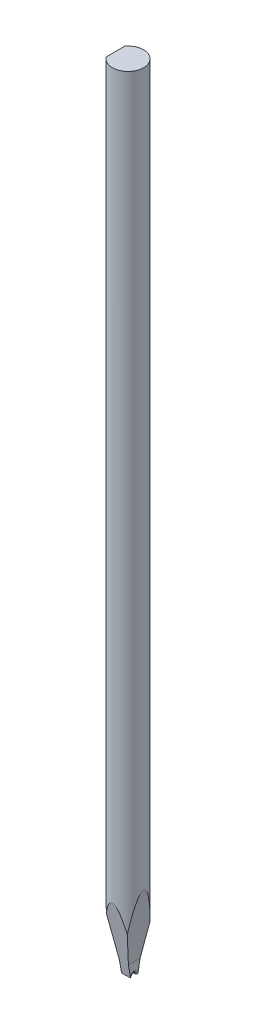
from build123d import *

# Parameters (mm, degrees)
SKETCH_TL_CUTTING_R    = 1.4986
TL_CUTTING_DEPTH       = 75.9968
SKETCH_TDF_CUTTING_W   = 3.01719996
SKETCH_TDF_CUTTING_H   = 3.01719996
TDF_CUTTING_DEPTH      = 77.026345527
VW_VR_GRINDING_DEPTH   = 1.50859998
VW_VR_GRINDING_2_DEPTH = 1.50859998
ISA_GRINDING_DEPTH     = 1.50859998
SKETCH_PRE_FRX_BRX_W   = 0.88916002
SKETCH_PRE_FRX_BRX_H   = 1.1938
SKETCH_PRE_FRX_BRX_W_2 = 1.24935996
PRE_FRX_BRX_DEPTH      = 1.50859998
FA_BA_GRINDING_DEPTH   = 1.50859998
BR_EDM_R               = 0.20066
FR_EDM_R               = 0.20066
ENGRAVING_DEPTH        = 0.005


with BuildPart() as part:
    # sketch_TL_cutting → TL_cutting (new body)
    with BuildSketch(Plane(origin=(0, 0, 0), x_dir=(1, 0, 0), z_dir=(0, 1, 0))):
        with Locations(Location((0, 0, 0), (0, 0, 270))):
            Circle(SKETCH_TL_CUTTING_R)
    extrude(amount=TL_CUTTING_DEPTH)

    # sketch_TDF_cutting → TDF_cutting (cut, through all)
    with BuildSketch(Plane(origin=(0, 0, 0), x_dir=(1, 0, 0), z_dir=(0, 1, 0))):
        with Locations((-2.71001998, 0)):
            Rectangle(SKETCH_TDF_CUTTING_W, SKETCH_TDF_CUTTING_H)
    extrude(amount=TDF_CUTTING_DEPTH, mode=Mode.SUBTRACT)


with BuildPart() as body_2:
    # sketch_VW_VR_grinding → VW_VR_grinding (new, symmetric)
    with BuildSketch(Plane(origin=(0, 0, 0), x_dir=(0, 0, -1), z_dir=(1, 0, 0))):
        with BuildLine():
            Line((-1.49360001, -0.00999998), (-1.49360001, 1.182688914))
            ThreePointArc((-1.49360001, 1.182688914), (-1.493648337, 1.183795792), (-1.493792952, 1.184894246))
            Line((-1.493792952, 1.184894246), (-1.51859996, 1.325581782))
            Line((-1.51859996, 1.325581782), (-1.50859998, -0.00999998))
            Line((-1.50859998, -0.00999998), (-1.49360001, -0.00999998))
        make_face()
    extrude(amount=VW_VR_GRINDING_DEPTH, both=True)


with BuildPart() as body_3:
    # sketch_VW_VR_grinding → VW_VR_grinding 2 (new, symmetric)
    with BuildSketch(Plane(origin=(0, 0, 0), x_dir=(0, 0, -1), z_dir=(1, 0, 0))):
        with BuildLine():
            Line((1.49360001, -0.00999998), (1.49360001, 1.182688914))
            ThreePointArc((1.49360001, 1.182688914), (1.493648337, 1.183795792), (1.493792952, 1.184894246))
            Line((1.493792952, 1.184894246), (1.51859996, 1.325581782))
            Line((1.51859996, 1.325581782), (1.50859998, -0.00999998))
            Line((1.50859998, -0.00999998), (1.49360001, -0.00999998))
        make_face()
    extrude(amount=VW_VR_GRINDING_2_DEPTH, both=True)


    add(body_2.part)  # ISA_grinding merges body 2
    # sketch_ISA_grinding → ISA_grinding (add, symmetric)
    with BuildSketch(Plane(origin=(0, 0, 0), x_dir=(0, 0, -1), z_dir=(1, 0, 0))):
        Polygon((-0.35052, 0), (0.35052, 0), (1.50859998, 6.567797936), (1.50859998, -0.02999994), (-1.50859998, -0.02999994), (-1.50859998, 6.567797936), align=None)
    extrude(amount=ISA_GRINDING_DEPTH, both=True)

    # sketch_pre_FRX_BRX → pre_FRX_BRX (add, symmetric)
    with BuildSketch(Plane.XY):
        with Locations((1.05401999, 0.58690002)):
            Rectangle(SKETCH_PRE_FRX_BRX_W, SKETCH_PRE_FRX_BRX_H)
        with Locations((-0.89391998, 0.58690002)):
            Rectangle(SKETCH_PRE_FRX_BRX_W_2, SKETCH_PRE_FRX_BRX_H)
    extrude(amount=PRE_FRX_BRX_DEPTH, both=True)

    # sketch_FA_BA_grinding → FA_BA_grinding (add, symmetric)
    with BuildSketch(Plane.XY):
        Polygon((0.59944, -0.00999998), (0.59944, 1.1938), (1.6256, 8.495307794), (1.6256, -0.00999998), align=None)
        Polygon((-0.26924, -0.00999998), (-0.26924, 1.1938), (-1.32842, 8.730257303), (-1.32842, -0.00999998), align=None)
    extrude(amount=FA_BA_GRINDING_DEPTH, both=True)


with BuildPart() as part_1:
    add(part.part)

    # B1_fix: cut body 3
    add(body_3.part, mode=Mode.SUBTRACT)

    # V-Groove_EDM: sweep along a path in sketch_contour_V-Groove
    with BuildLine(Plane.XY) as v_groove_edm_path:
        Line((-1.20142, 0.254), (1.4986, 0.254))
    # sketch_section_V-Groove → V-Groove_EDM (sweep, cut)
    with BuildSketch(Plane(origin=(-1.20142, 0, -1.2954), x_dir=(0, 0, -1), z_dir=(1, 0, 0))):
        with BuildLine():
            Line((-1.228819322, 0.219340293), (-1.068233534, -0.00999998))
            Line((-1.068233534, -0.00999998), (-1.522566466, -0.00999998))
            Line((-1.522566466, -0.00999998), (-1.361980678, 0.219340293))
            ThreePointArc((-1.361980678, 0.219340293), (-1.2954, 0.254), (-1.228819322, 0.219340293))
        make_face()
    sweep(path=v_groove_edm_path.line, mode=Mode.SUBTRACT)

    # BR_EDM
    br_edm_edges = [part_1.edges().sort_by_distance(p)[0] for p in [
        (-0.26924, 0.254, 0),
        (-0.26924, 0.109670146, -0.143372541),
        (-0.26924, 0.109670146, 0.143372541),
    ]]
    fillet(br_edm_edges, radius=BR_EDM_R)

    # FR_EDM
    fr_edm_edges = [part_1.edges().sort_by_distance(p)[0] for p in [
        (0.59944, 0.109670146, -0.143372541),
        (0.59944, 0.109670146, 0.143372541),
        (0.59944, 0.254, 0),
    ]]
    fillet(fr_edm_edges, radius=FR_EDM_R)

    # sketch_Engraving → Engraving (cut)
    # profile 1 of 9: a face of its own
    with BuildSketch(Plane.ZY.offset(1.20142)):
        Polygon((-1.243778574, 44.904278925), (-1.116218735, 45.030283156), (-0.926693853, 45.157065191), (-0.67598173, 45.284884298), (-0.359674813, 45.346849342), (-0.105332939, 45.346849342), (0.210973979, 45.284884298), (0.463500977, 45.157065191), (0.65302586, 45.030283156), (0.780585699, 44.904278925), (0.75880719, 44.88327822), (0.635654906, 45.008245379), (0.449500507, 45.132434734), (0.200343992, 45.255846286), (-0.10896269, 45.318848401), (-0.356045061, 45.318848401), (-0.665351744, 45.255846286), (-0.912693382, 45.132434734), (-1.098847782, 45.008245379), (-1.222000065, 44.88327822), align=None)
    # profile 2 of 9: a face of its own
    with BuildSketch(Plane.ZY.offset(1.20142)):
        Polygon((-1.044660777, 44.315429522), (-0.806912053, 44.315429522), (-0.747280421, 44.498991242), (-0.620498386, 44.630699368), (-0.598460609, 44.608402323), (-0.722909232, 44.484731503), (-0.777874041, 44.315429522), (-0.070331763, 44.315429522), (-0.052701542, 44.369097991), (0.010559842, 44.498731974), (0.077450977, 44.565623109), (0.208899835, 44.630699368), (0.344496981, 44.630699368), (0.477501447, 44.496917098), (0.539207223, 44.315429522), (0.780585699, 44.315429522), (0.780585699, 44.282243223), (0.544392582, 44.282243223), (0.544392582, 44.066532275), (0.780585699, 44.066532275), (0.780585699, 44.033345976), (0.539207223, 44.033345976), (0.477760715, 43.849006453), (0.35097868, 43.71807613), (0.328940903, 43.739336103), (0.453389527, 43.864043995), (0.508354335, 44.033345976), (-0.135667291, 44.033345976), (-0.153297512, 43.979677507), (-0.216558896, 43.849265721), (-0.283450031, 43.782374586), (-0.414898889, 43.71807613), (-0.614016686, 43.71807613), (-0.747021153, 43.851080596), (-0.806912053, 44.033345976), (-1.044660777, 44.033345976), (-1.044660777, 44.066532275), (-0.811838144, 44.066532275), (-0.811838144, 44.282243223), (-1.044660777, 44.282243223), align=None)
        Polygon((-0.777874041, 44.033345976), (-0.722390696, 43.87104423), (-0.602608896, 43.752040234), (-0.422936196, 43.752040234), (-0.30133952, 43.813227473), (-0.242226424, 43.872859105), (-0.178705773, 43.994455781), (-0.164705303, 44.037234995), align=None, mode=Mode.SUBTRACT)
        Polygon((-0.081739554, 44.282243223), (-0.778392576, 44.282243223), (-0.778392576, 44.066532275), (-0.155371656, 44.066532275), align=None, mode=Mode.SUBTRACT)
        Polygon((0.509132139, 44.282243223), (-0.05166447, 44.282243223), (-0.125037304, 44.066532275), (0.509132139, 44.066532275), align=None, mode=Mode.SUBTRACT)
        Polygon((-0.042071555, 44.315429522), (0.508354335, 44.311540503), (0.452870991, 44.481620288), (0.333089191, 44.59984648), (0.21590007, 44.59984648), (0.095340467, 44.539437044), (0.03622737, 44.48006468), (-0.027034013, 44.358208736), align=None, mode=Mode.SUBTRACT)
    # profile 3 of 9: a face of its own
    with BuildSketch(Plane.ZY.offset(1.20142)):
        Polygon((-0.124518768, 42.895885559), (-0.124518768, 43.384087137), (-0.785133544, 43.384087137), (-0.785133544, 42.582689857), (-0.81235668, 42.582689857), (-0.81235668, 43.412088078), (0.531688452, 43.412088078), (0.531688452, 42.582689857), (0.502909708, 42.582689857), (0.502909708, 43.384087137), (-0.095740024, 43.384087137), (-0.095740024, 42.895885559), align=None)
    # profile 4 of 9: a face of its own
    with BuildSketch(Plane.ZY.offset(1.20142)):
        Polygon((-0.79576353, 42.311962247), (0.085488284, 42.311962247), (0.085488284, 42.283961307), (-0.131519003, 42.283961307), (0.03622737, 42.118548345), (0.100266558, 41.988395827), (0.100266558, 41.792389245), (0.034412495, 41.658347707), (-0.138778506, 41.602345826), (0.03622737, 41.429154825), (0.100266558, 41.297965235), (0.100266558, 41.102736457), (0.034412495, 40.967917115), (-0.164186767, 40.904137196), (-0.79576353, 40.904137196), (-0.79576353, 40.932138136), (-0.17014993, 40.932138136), (0.009263502, 40.993325376), (0.068895134, 41.109736692), (0.068895134, 41.290965), (0.007448626, 41.4107468), (-0.173520413, 41.593530715), (-0.79576353, 41.593530715), (-0.79576353, 41.622568728), (-0.17014993, 41.622568728), (0.009263502, 41.682978163), (0.068895134, 41.800167284), (0.068895134, 41.98035852), (0.007448626, 42.101177391), (-0.173520413, 42.283961307), (-0.79576353, 42.283961307), align=None)
    # profile 5 of 9: a face of its own
    with BuildSketch(Plane.ZY.offset(1.20142)):
        Polygon((0.086525356, 40.503516336), (-0.067479816, 40.503516336), (0.036486638, 40.40110549), (0.100266558, 40.269915899), (0.100266558, 40.074946389), (0.036486638, 39.944534603), (-0.094702952, 39.81490062), (-0.287598318, 39.750083629), (-0.416973033, 39.750083629), (-0.610127667, 39.81490062), (-0.740280186, 39.944534603), (-0.803282301, 40.074946389), (-0.803282301, 40.269915899), (-0.740280186, 40.40110549), (-0.636313731, 40.503516336), (-1.227185424, 40.503516336), (-1.227185424, 40.531517276), (0.086525356, 40.531517276), align=None)
        Polygon((-0.110518298, 40.503516336), (-0.601571824, 40.503516336), (-0.72057582, 40.382956732), (-0.780985256, 40.262915664), (-0.780985256, 40.081946624), (-0.72057582, 39.961905556), (-0.599756948, 39.840308881), (-0.416973033, 39.779121641), (-0.295117089, 39.779121641), (-0.112333174, 39.840308881), (0.007448626, 39.961905556), (0.068895134, 40.081946624), (0.068895134, 40.262915664), (0.007448626, 40.382956732), align=None, mode=Mode.SUBTRACT)
    # profile 6 of 9: a face of its own
    with BuildSketch(Plane.ZY.offset(1.20142)):
        Polygon((-0.81235668, 39.041193158), (-0.81235668, 39.169790069), (-0.747798957, 39.304609411), (-0.551273839, 39.369426402), (0.062672703, 39.369426402), (0.062672703, 39.542617403), (0.090673643, 39.542617403), (0.090673643, 39.369426402), (0.515095302, 39.369426402), (0.515095302, 39.34038839), (0.090673643, 39.34038839), (0.090673643, 39.10341747), (0.062672703, 39.10341747), (0.062672703, 39.34038839), (-0.547644087, 39.34038839), (-0.726798251, 39.27920115), (-0.785392812, 39.162789834), (-0.785392812, 39.041193158), align=None)
    # profile 7 of 9: a face of its own
    with BuildSketch(Plane.ZY.offset(1.20142)):
        Polygon((-1.21499983, 38.953508732), (-1.21499983, 38.8938771), (-1.154071858, 38.7740953), (-1.033252986, 38.652498624), (-0.794985726, 38.530901949), (0.073302689, 38.903729283), (0.083673408, 38.878321022), (-0.759206747, 38.514308799), (0.083673408, 38.150296576), (0.073302689, 38.125666119), (-0.79835621, 38.501863937), (-1.051661012, 38.627090364), (-1.179480119, 38.756724347), (-1.243778574, 38.886876865), (-1.243778574, 38.953508732), align=None)
    # profile 8 of 9: a face of its own
    with BuildSketch(Plane.ZY.offset(1.20142)):
        Polygon((-1.044660777, 37.631708792), (-0.806912053, 37.631708792), (-0.747280421, 37.815270511), (-0.620498386, 37.946978637), (-0.598460609, 37.924681592), (-0.722909232, 37.801010773), (-0.777874041, 37.631708792), (-0.070331763, 37.631708792), (-0.052701542, 37.68537726), (0.010559842, 37.815011243), (0.077450977, 37.881902378), (0.208899835, 37.946978637), (0.344496981, 37.946978637), (0.477501447, 37.813196367), (0.539207223, 37.631708792), (0.780585699, 37.631708792), (0.780585699, 37.598522492), (0.544392582, 37.598522492), (0.544392582, 37.382811545), (0.780585699, 37.382811545), (0.780585699, 37.349625245), (0.539207223, 37.349625245), (0.477760715, 37.165285722), (0.35097868, 37.0343554), (0.328940903, 37.055615373), (0.453389527, 37.180323264), (0.508354335, 37.349625245), (-0.135667291, 37.349625245), (-0.153297512, 37.295956777), (-0.216558896, 37.16554499), (-0.283450031, 37.098653855), (-0.414898889, 37.0343554), (-0.614016686, 37.0343554), (-0.747021153, 37.167359866), (-0.806912053, 37.349625245), (-1.044660777, 37.349625245), (-1.044660777, 37.382811545), (-0.811838144, 37.382811545), (-0.811838144, 37.598522492), (-1.044660777, 37.598522492), align=None)
        Polygon((-0.777874041, 37.349625245), (-0.722390696, 37.187323499), (-0.602608896, 37.068319503), (-0.422936196, 37.068319503), (-0.30133952, 37.129506743), (-0.242226424, 37.189138375), (-0.178705773, 37.310735051), (-0.164705303, 37.353514265), align=None, mode=Mode.SUBTRACT)
        Polygon((-0.081739554, 37.598522492), (-0.778392576, 37.598522492), (-0.778392576, 37.382811545), (-0.155371656, 37.382811545), align=None, mode=Mode.SUBTRACT)
        Polygon((0.509132139, 37.598522492), (-0.05166447, 37.598522492), (-0.125037304, 37.382811545), (0.509132139, 37.382811545), align=None, mode=Mode.SUBTRACT)
        Polygon((-0.042071555, 37.631708792), (0.508354335, 37.627819772), (0.452870991, 37.797899557), (0.333089191, 37.916125749), (0.21590007, 37.916125749), (0.095340467, 37.855716314), (0.03622737, 37.79634395), (-0.027034013, 37.674488006), align=None, mode=Mode.SUBTRACT)
    # profile 9 of 9: a face of its own
    with BuildSketch(Plane.ZY.offset(1.20142)):
        Polygon((-1.222000065, 36.787998979), (-1.098847782, 36.662772552), (-0.912693382, 36.538583196), (-0.665351744, 36.415171645), (-0.356045061, 36.352169529), (-0.10896269, 36.352169529), (0.200343992, 36.415171645), (0.449500507, 36.538583196), (0.635654906, 36.662772552), (0.75880719, 36.787998979), (0.780585699, 36.765961202), (0.65302586, 36.640994043), (0.463500977, 36.51395274), (0.210973979, 36.386392901), (-0.105332939, 36.323390785), (-0.359674813, 36.323390785), (-0.67598173, 36.386392901), (-0.926693853, 36.51395274), (-1.116218735, 36.640994043), (-1.243778574, 36.765961202), align=None)
    extrude(amount=-ENGRAVING_DEPTH, mode=Mode.SUBTRACT)


solid = part_1.part
